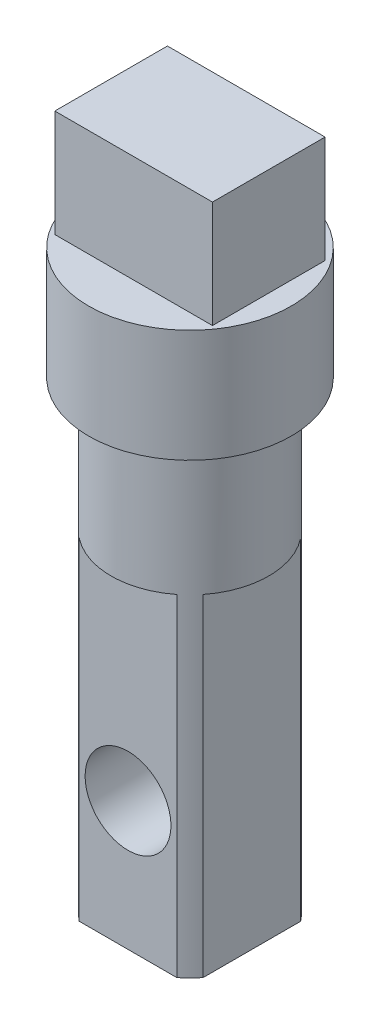
from build123d import *

# Parameters (mm, degrees)
SKETCH1_R           = 7
BOSS_EXTRUDE1_DEPTH = 46.228
SKETCH2_R           = 9
BOSS_EXTRUDE2_DEPTH = 5
SKETCH3_W           = 14
SKETCH3_H           = 10
BOSS_EXTRUDE3_DEPTH = 9.5
SKETCH4_OUTSIDE_W   = 33.17
SKETCH4_OUTSIDE_H   = 33.17
SKETCH4_OUTSIDE_W_2 = 11
SKETCH4_OUTSIDE_H_2 = 11
CUT_EXTRUDE1_DEPTH  = 29.464
SKETCH5_R           = 3.81
CUT_EXTRUDE2_DEPTH  = 64.080424729


with BuildPart() as part:
    # Sketch1 → Boss-Extrude1 (new body)
    with BuildSketch(Plane(origin=(0, 0, 0), x_dir=(1, 0, 0), z_dir=(0, 1, 0))):
        Circle(SKETCH1_R)
    extrude(amount=BOSS_EXTRUDE1_DEPTH)

    # Sketch2 → Boss-Extrude2 (add, symmetric)
    with BuildSketch(Plane(origin=(0, 46.228, 0), x_dir=(1, 0, 0), z_dir=(0, 1, 0))):
        Circle(SKETCH2_R)
    extrude(amount=BOSS_EXTRUDE2_DEPTH, both=True)

    # Sketch3 → Boss-Extrude3 (add)
    with BuildSketch(Plane(origin=(0, 51.228, 0), x_dir=(1, 0, 0), z_dir=(0, 1, 0))):
        Rectangle(SKETCH3_W, SKETCH3_H)
    extrude(amount=BOSS_EXTRUDE3_DEPTH)

    # Sketch4 outside → Cut-Extrude1 (cut)
    with BuildSketch(Plane(origin=(0, 0, 0), x_dir=(1, 0, 0), z_dir=(0, 1, 0))):
        Rectangle(SKETCH4_OUTSIDE_W, SKETCH4_OUTSIDE_H)
        Rectangle(SKETCH4_OUTSIDE_W_2, SKETCH4_OUTSIDE_H_2, mode=Mode.SUBTRACT)
    extrude(amount=CUT_EXTRUDE1_DEPTH, mode=Mode.SUBTRACT)

    # Sketch5 → Cut-Extrude2 (cut, through all)
    with BuildSketch(Plane(origin=(0, 0, -5.5), x_dir=(-1, 0, 0), z_dir=(0, 0, -1))):
        with Locations((0, 11.43)):
            Circle(SKETCH5_R)
    extrude(amount=-CUT_EXTRUDE2_DEPTH, mode=Mode.SUBTRACT)


solid = part.part
